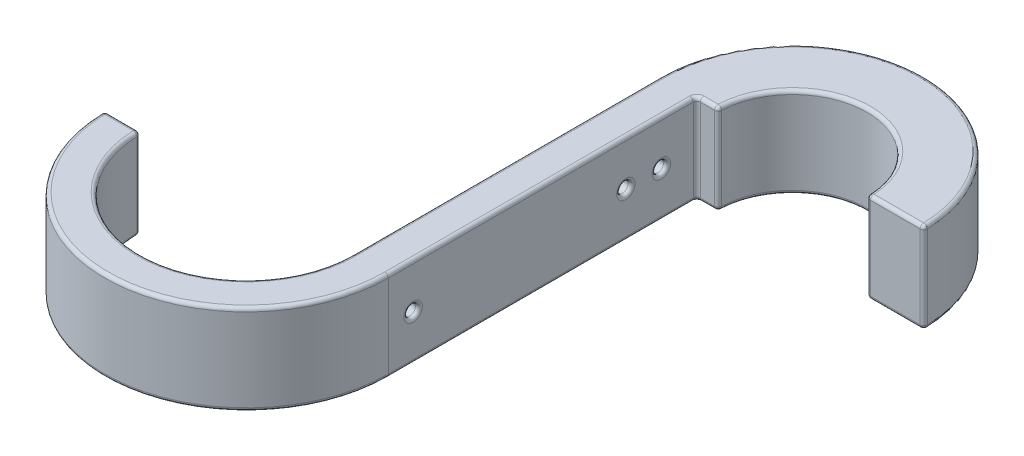
from build123d import *

# Parameters (mm, degrees)
BOSS_EXTRUDE1_DEPTH = 25.4
SKETCH3_R           = 1.6
CUT_EXTRUDE2_DEPTH  = 153.230614529
FILLET1_R           = 1


with BuildPart() as part:
    # Sketch1 → Boss-Extrude1 (new body)
    with BuildSketch(Plane(origin=(0, 0, 0), x_dir=(1, 0, 0), z_dir=(0, 1, 0))):
        with BuildLine():
            Line((42, 0), (58, 0))
            ThreePointArc((58, 0), (21, 37), (-16, 0))
            Line((-16, 0), (-16, -87))
            ThreePointArc((-16, -87), (-46, -117), (-76, -87))
            Line((-76, -87), (-86, -87))
            ThreePointArc((-86, -87), (-46, -127), (-6, -87))
            Line((-6, -87), (-6, 0))
            Line((-6, 0), (0, 0))
            ThreePointArc((0, 0), (21, 21), (42, 0))
        make_face()
    extrude(amount=BOSS_EXTRUDE1_DEPTH)

    # Sketch3 → Cut-Extrude2 (cut, through all)
    with BuildSketch(Plane(origin=(-6, 0, 0), x_dir=(0, 0, -1), z_dir=(1, 0, 0))):
        with Locations((-20, 12.7)):
            Circle(SKETCH3_R)
        with Locations((-10, 12.7)):
            Circle(SKETCH3_R)
        with Locations((-80, 12.7)):
            Circle(SKETCH3_R)
    extrude(amount=-CUT_EXTRUDE2_DEPTH, mode=Mode.SUBTRACT)

    # Fillet1
    fillet1_edges = [part.edges().sort_by_distance(p)[0] for p in [
        (-46, 25.4, 127),
        (-46, 0, 117),
        (-81, 0, 87),
        (-46, 0, 127),
        (-6, 0, 43.5),
        (-3, 0, 0),
        (-81, 25.4, 87),
        (0, 12.7, 0),
        (42, 12.7, 0),
        (58, 12.7, 0),
        (-76, 12.7, 87),
        (-86, 12.7, 87),
        (-6, 12.7, 0),
        (-46, 25.4, 117),
        (-16, 25.4, 43.5),
        (21, 25.4, -37),
        (50, 25.4, 0),
        (-16, 12.7, 21.6),
        (-6, 12.7, 21.6),
        (21, 25.4, -21),
        (-16, 12.7, 11.6),
        (-6, 12.7, 11.6),
        (-16, 12.7, 81.6),
        (-6, 12.7, 81.6),
        (-3, 25.4, 0),
        (-6, 25.4, 43.5),
        (21, 0, -21),
        (50, 0, 0),
        (21, 0, -37),
        (-16, 0, 43.5),
    ]]
    fillet(fillet1_edges, radius=FILLET1_R)


solid = part.part
